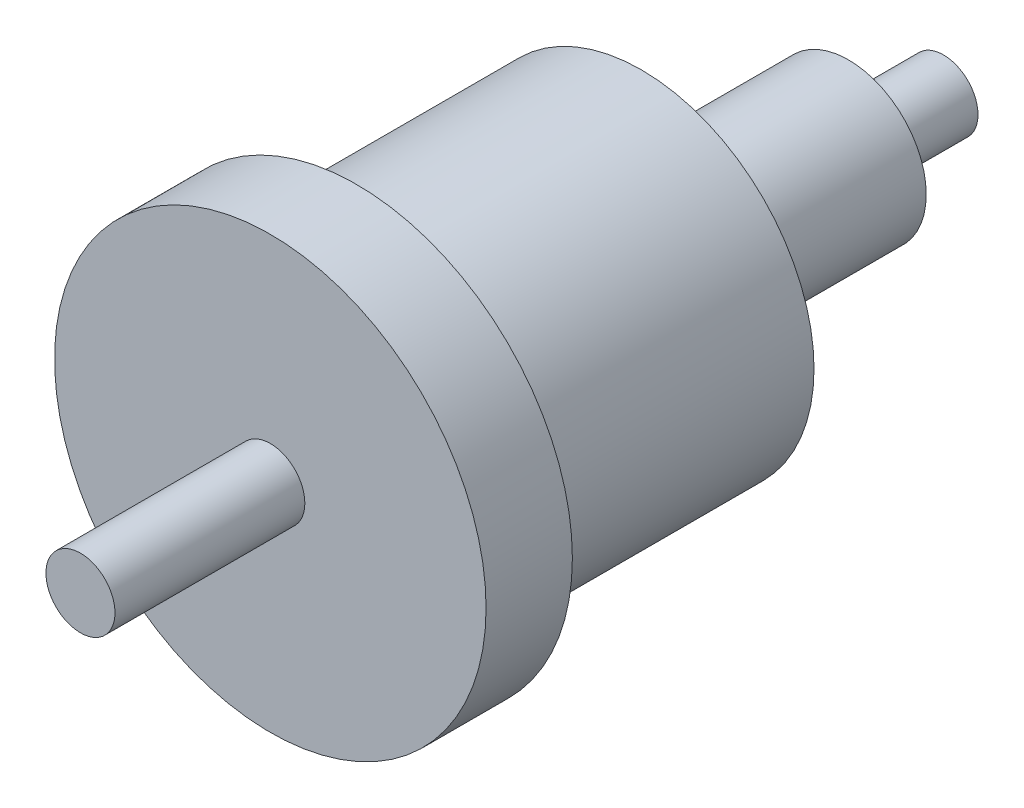
from build123d import *

# Parameters (mm, degrees)
SKETCH1_R           = 0.4
BOSS_EXTRUDE1_DEPTH = 1.1
SKETCH2_R           = 0.9
BOSS_EXTRUDE2_DEPTH = 2.4
SKETCH3_R           = 2
BOSS_EXTRUDE3_DEPTH = 3.3
SKETCH4_R           = 2.5
BOSS_EXTRUDE4_DEPTH = 1
SKETCH5_R           = 0.4
BOSS_EXTRUDE5_DEPTH = 2.2


with BuildPart() as part:
    # Sketch1 → Boss-Extrude1 (new body)
    with BuildSketch(Plane.XY):
        Circle(SKETCH1_R)
    extrude(amount=BOSS_EXTRUDE1_DEPTH)

    # Sketch2 → Boss-Extrude2 (add)
    with BuildSketch(Plane.XY.offset(1.1)):
        Circle(SKETCH2_R)
    extrude(amount=BOSS_EXTRUDE2_DEPTH)

    # Sketch3 → Boss-Extrude3 (add)
    with BuildSketch(Plane.XY.offset(3.5)):
        Circle(SKETCH3_R)
    extrude(amount=BOSS_EXTRUDE3_DEPTH)

    # Sketch4 → Boss-Extrude4 (add)
    with BuildSketch(Plane.XY.offset(6.8)):
        Circle(SKETCH4_R)
    extrude(amount=BOSS_EXTRUDE4_DEPTH)

    # Sketch5 → Boss-Extrude5 (add)
    with BuildSketch(Plane.XY.offset(7.8)):
        Circle(SKETCH5_R)
    extrude(amount=BOSS_EXTRUDE5_DEPTH)


solid = part.part
